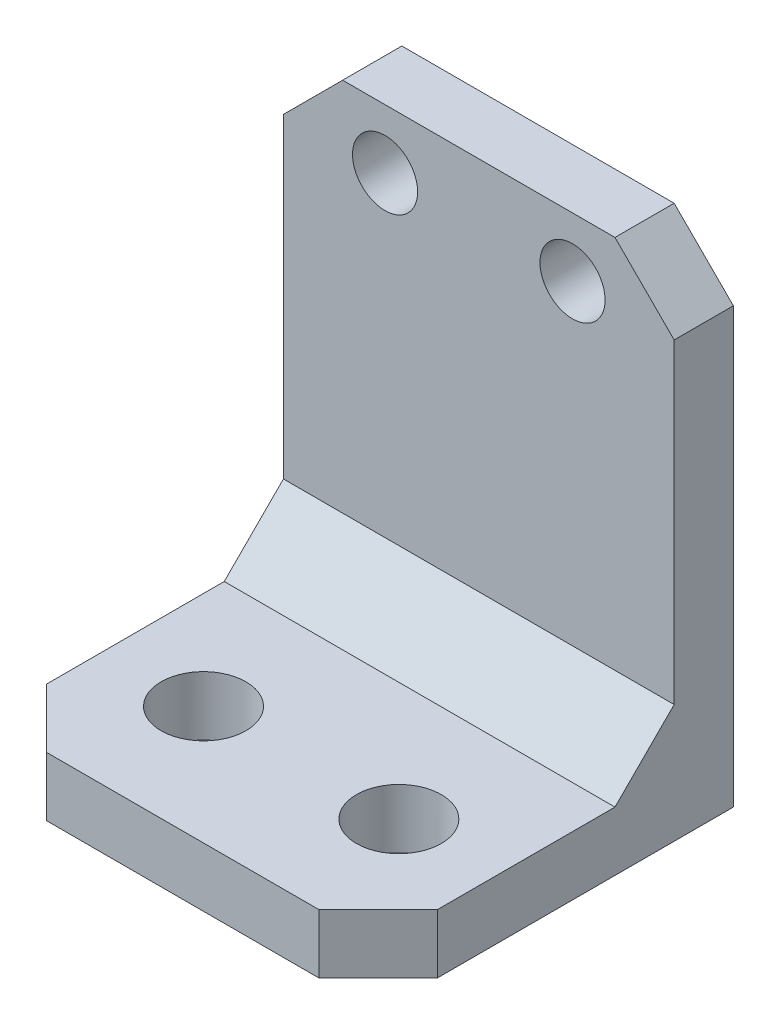
from build123d import *

# Parameters (mm, degrees)
SKETCH1_W           = 19.8
SKETCH1_H           = 25
SKETCH1_R           = 1.65
BOSS_EXTRUDE1_DEPTH = 3
SKETCH2_W           = 19.8
SKETCH2_H           = 3
BOSS_EXTRUDE2_DEPTH = 15
CHAMFER1_SIZE       = 3
SKETCH4_R           = 2.15
CUT_EXTRUDE1_DEPTH  = 15
CHAMFER2_SIZE       = 3


with BuildPart() as part:
    # Sketch1 → Boss-Extrude1 (new body)
    with BuildSketch(Plane.XY):
        with Locations((0, 1.287671233)):
            Rectangle(SKETCH1_W, SKETCH1_H)
        with Locations((-4.75, 10.787671233)):
            Circle(SKETCH1_R, mode=Mode.SUBTRACT)
        with Locations(Location((4.75, 10.787671233, 0), (0, 0, 180))):
            Circle(SKETCH1_R, mode=Mode.SUBTRACT)
    extrude(amount=BOSS_EXTRUDE1_DEPTH)

    # Sketch2 → Boss-Extrude2 (add)
    with BuildSketch(Plane.XY.offset(3)):
        with Locations((0, -9.712328767)):
            Rectangle(SKETCH2_W, SKETCH2_H)
    extrude(amount=BOSS_EXTRUDE2_DEPTH)

    # Chamfer1
    chamfer1_edges = [part.edges().sort_by_distance(p)[0] for p in [
        (0, -8.212328767, 3),
        (-9.9, 13.787671233, 1.5),
        (9.9, 13.787671233, 1.5),
    ]]
    chamfer(chamfer1_edges, length=CHAMFER1_SIZE)

    # Sketch4 → Cut-Extrude1 (cut)
    with BuildSketch(Plane(origin=(0, -8.212328767, 0), x_dir=(1, 0, 0), z_dir=(0, 1, 0))):
        with Locations(Location((4.95, -12, 0), (0, 0, 270))):
            Circle(SKETCH4_R)
        with Locations(Location((-4.95, -12, 0), (0, 0, 180))):
            Circle(SKETCH4_R)
    extrude(amount=-CUT_EXTRUDE1_DEPTH, mode=Mode.SUBTRACT)

    # Chamfer2
    chamfer2_edges = [part.edges().sort_by_distance(p)[0] for p in [
        (-9.9, -9.712328767, 18),
        (9.9, -9.712328767, 18),
    ]]
    chamfer(chamfer2_edges, length=CHAMFER2_SIZE)


solid = part.part
